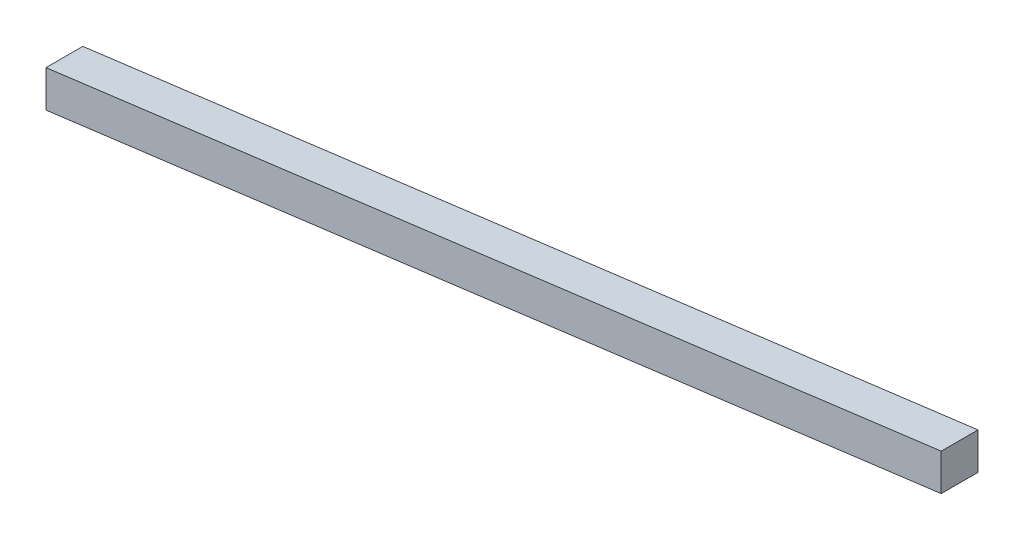
from build123d import *

# Parameters (mm, degrees)
BOSS_EXTRUDE1_DEPTH = 6


with BuildPart() as part:
    # Sketch1 → Boss-Extrude1 (new body)
    with BuildSketch(Plane(origin=(0, 0, 0), x_dir=(0, 1, 0), z_dir=(0, 0, 1))):
        Polygon((-12.4164, 73.00625), (-6.4164, 73.00625), (12.4164, -73.00625), (6.4164, -73.00625), align=None)
    extrude(amount=BOSS_EXTRUDE1_DEPTH)


solid = part.part
